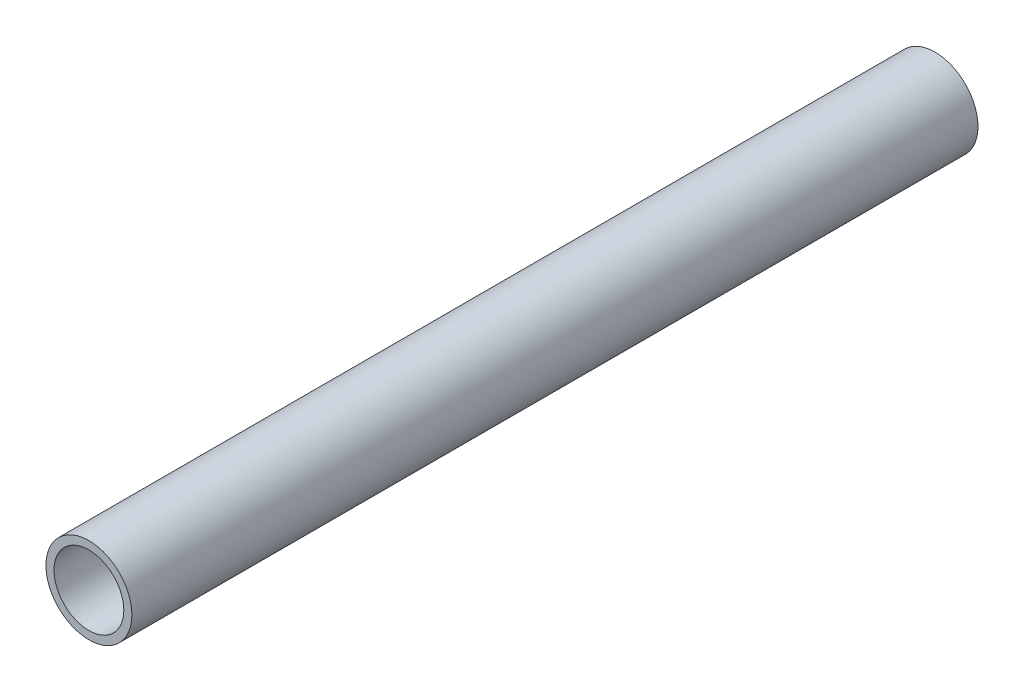
from build123d import *

# Parameters (mm, degrees)
CROQUIS1_R     = 16
EXTRUIR1_DEPTH = 157.5
VACIADO1_T     = -3


with BuildPart() as part:
    # Croquis1 → Extruir1 (new, symmetric)
    with BuildSketch(Plane.XY):
        Circle(CROQUIS1_R)
    extrude(amount=EXTRUIR1_DEPTH, both=True)

    # Vaciado1
    vaciado1_openings = [part.faces().sort_by_distance(p)[0] for p in [
        (0, 0, 157.5),
        (0, 0, -157.5),
    ]]
    offset(amount=VACIADO1_T, openings=vaciado1_openings, kind=Kind.INTERSECTION)


solid = part.part
